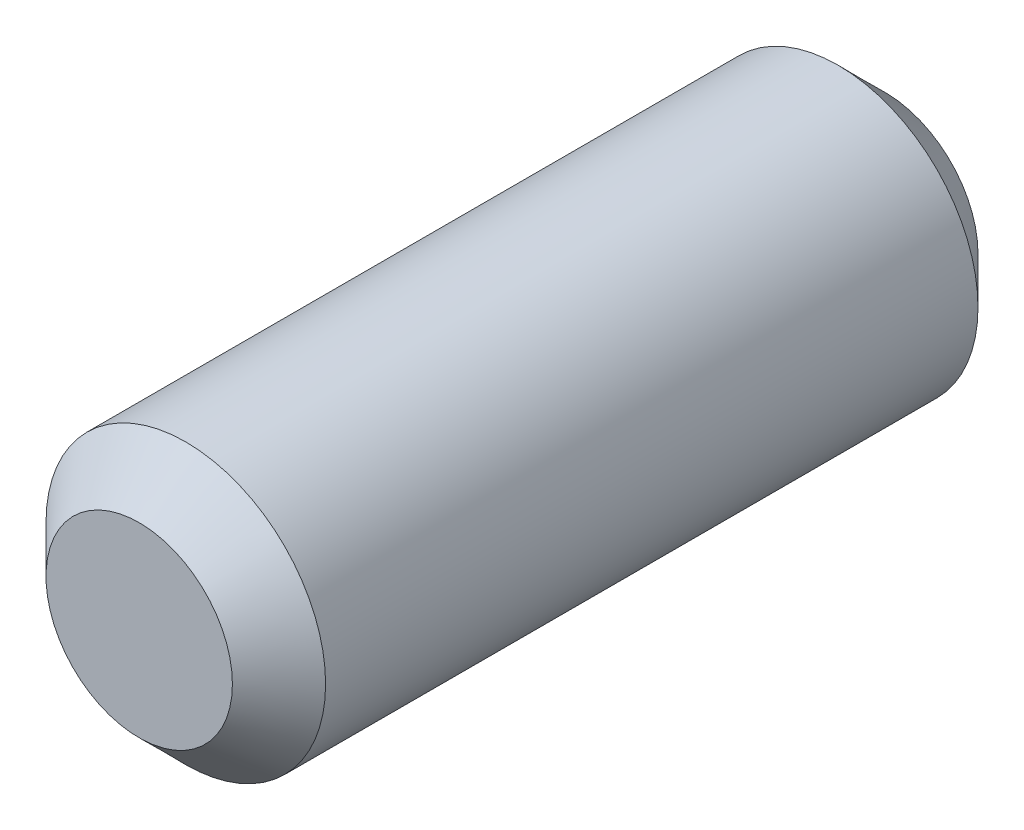
from build123d import *

# Parameters (mm, degrees)
ESQUISSE1_R        = 1.5
BOSS_EXTRU_1_DEPTH = 8
CHANFREIN1_SIZE    = 0.5


with BuildPart() as part:
    # Esquisse1 → Boss.-Extru.1 (new body)
    with BuildSketch(Plane.XY):
        Circle(ESQUISSE1_R)
    extrude(amount=BOSS_EXTRU_1_DEPTH)

    # Chanfrein1
    chanfrein1_edges = [part.edges().sort_by_distance(p)[0] for p in [
        (-1.5, 0, 0),
        (-1.5, 0, 8),
    ]]
    chamfer(chanfrein1_edges, length=CHANFREIN1_SIZE)


solid = part.part
